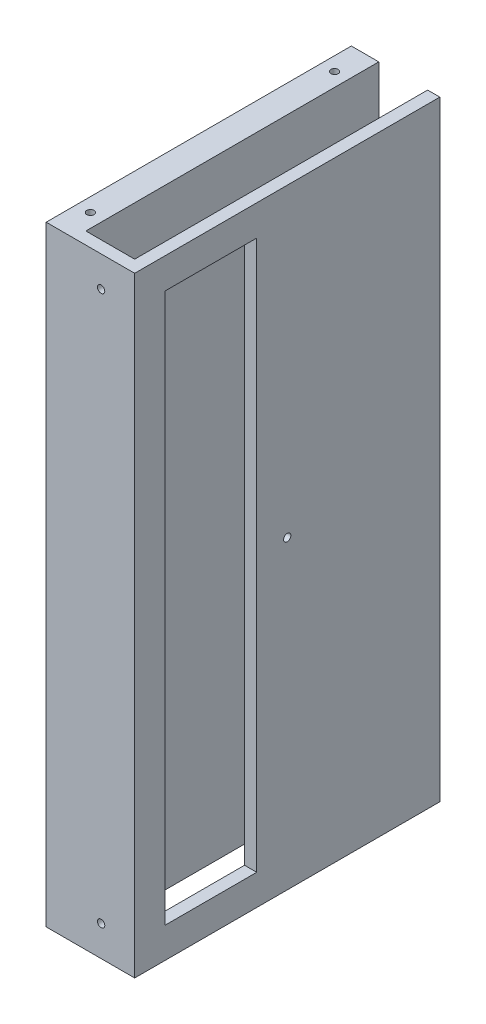
from build123d import *

# Parameters (mm, degrees)
SKETCH1_W                 = 29
SKETCH1_H                 = 100
BOSS_EXTRUDE1_DEPTH       = 200
SKETCH2_W                 = 16
SKETCH2_H                 = 96
CUT_EXTRUDE1_DEPTH        = 207.664583323
SKETCH3_W                 = 30
SKETCH3_H                 = 180
CUT_EXTRUDE2_DEPTH        = 4
M2_CLEARANCE_HOLE1_D      = 2.4
M2_CLEARANCE_HOLE1_DEPTH  = 11.2
M2_CLEARANCE_HOLE1_TIP    = 0.721032743
M2_CLEARANCE_HOLE2_D      = 2.4
M2_CLEARANCE_HOLE2_DEPTH  = 11.2
M2_CLEARANCE_HOLE2_TIP    = 0.721032743
M2_CLEARANCE_HOLE3_REACH  = 210.185
M2_CLEARANCE_HOLE3_BORE_R = 1.2
M2_CLEARANCE_HOLE4_REACH  = 210.185
M2_CLEARANCE_HOLE4_BORE_R = 1.2
M2_CLEARANCE_HOLE5_D      = 2.4


with BuildPart() as part:
    # Sketch1 → Boss-Extrude1 (new body)
    with BuildSketch(Plane(origin=(0, 0, 0), x_dir=(1, 0, 0), z_dir=(0, 1, 0))):
        Rectangle(SKETCH1_W, SKETCH1_H)
    extrude(amount=BOSS_EXTRUDE1_DEPTH)

    # Sketch2 → Cut-Extrude1 (cut, through all)
    with BuildSketch(Plane(origin=(0, 200, 0), x_dir=(1, 0, 0), z_dir=(0, 1, 0))):
        with Locations((2.5, 2)):
            Rectangle(SKETCH2_W, SKETCH2_H)
    extrude(amount=-CUT_EXTRUDE1_DEPTH, mode=Mode.SUBTRACT)

    # Sketch3 → Cut-Extrude2 (cut)
    with BuildSketch(Plane(origin=(14.5, 0, 0), x_dir=(0, 0, -1), z_dir=(1, 0, 0))):
        with Locations((-25, 100)):
            Rectangle(SKETCH3_W, SKETCH3_H)
    extrude(amount=-CUT_EXTRUDE2_DEPTH, mode=Mode.SUBTRACT)

    # M2 Clearance Hole1
    with Locations(Plane(origin=(0, 200, 0), x_dir=(1, 0, 0), z_dir=(0, 1, 0))):
        with Locations((-10, 40), (-10, -40)):
            Hole(M2_CLEARANCE_HOLE1_D / 2, depth=M2_CLEARANCE_HOLE1_DEPTH)
            with Locations((0, 0, -(M2_CLEARANCE_HOLE1_DEPTH + M2_CLEARANCE_HOLE1_TIP / 2))):  # 118° drill point
                Cone(0, M2_CLEARANCE_HOLE1_D / 2, M2_CLEARANCE_HOLE1_TIP, mode=Mode.SUBTRACT)

    # M2 Clearance Hole2
    with Locations(Plane(origin=(0, 0, 0), x_dir=(-1, 0, 0), z_dir=(0, -1, 0))):
        with Locations((10, 40), (10, -40)):
            Hole(M2_CLEARANCE_HOLE2_D / 2, depth=M2_CLEARANCE_HOLE2_DEPTH)
            with Locations((0, 0, -(M2_CLEARANCE_HOLE2_DEPTH + M2_CLEARANCE_HOLE2_TIP / 2))):  # 118° drill point
                Cone(0, M2_CLEARANCE_HOLE2_D / 2, M2_CLEARANCE_HOLE2_TIP, mode=Mode.SUBTRACT)

    # M2 Clearance Hole3 bore → M2 Clearance Hole3 (cut, up to next)
    with BuildSketch(Plane.ZY.offset(14.5), mode=Mode.PRIVATE) as m2_clearance_hole3_sk1:
        with Locations((-30, 180)):
            Circle(M2_CLEARANCE_HOLE3_BORE_R)
    m2_clearance_hole3_tool1 = extrude(m2_clearance_hole3_sk1.sketch, amount=-M2_CLEARANCE_HOLE3_REACH, mode=Mode.PRIVATE) & part.part
    # M2 Clearance Hole3 bore → M2 Clearance Hole3 (cut, up to next)
    with BuildSketch(Plane.ZY.offset(14.5), mode=Mode.PRIVATE) as m2_clearance_hole3_sk2:
        with Locations((-30, 20)):
            Circle(M2_CLEARANCE_HOLE3_BORE_R)
    m2_clearance_hole3_tool2 = extrude(m2_clearance_hole3_sk2.sketch, amount=-M2_CLEARANCE_HOLE3_REACH, mode=Mode.PRIVATE) & part.part
    # M2 Clearance Hole3 bore → M2 Clearance Hole3 (cut, up to next)
    with BuildSketch(Plane.ZY.offset(14.5), mode=Mode.PRIVATE) as m2_clearance_hole3_sk3:
        with Locations((30, 100)):
            Circle(M2_CLEARANCE_HOLE3_BORE_R)
    m2_clearance_hole3_tool3 = extrude(m2_clearance_hole3_sk3.sketch, amount=-M2_CLEARANCE_HOLE3_REACH, mode=Mode.PRIVATE) & part.part
    add(m2_clearance_hole3_tool1.solids().sort_by_distance((-14.5, 180, -30))[0], mode=Mode.SUBTRACT)
    add(m2_clearance_hole3_tool2.solids().sort_by_distance((-14.5, 20, -30))[0], mode=Mode.SUBTRACT)
    add(m2_clearance_hole3_tool3.solids().sort_by_distance((-14.5, 100, 30))[0], mode=Mode.SUBTRACT)

    # M2 Clearance Hole4 bore → M2 Clearance Hole4 (cut, up to next)
    with BuildSketch(Plane(origin=(14.5, 0, 0), x_dir=(0, 0, -1), z_dir=(1, 0, 0)), mode=Mode.PRIVATE) as m2_clearance_hole4_sk1:
        with Locations((0, 100)):
            Circle(M2_CLEARANCE_HOLE4_BORE_R)
    m2_clearance_hole4_tool1 = extrude(m2_clearance_hole4_sk1.sketch, amount=-M2_CLEARANCE_HOLE4_REACH, mode=Mode.PRIVATE) & part.part
    add(m2_clearance_hole4_tool1.solids().sort_by_distance((14.5, 100, 0))[0], mode=Mode.SUBTRACT)

    # M2 Clearance Hole5 (through all)
    with Locations(Plane.XY.offset(50)):
        with Locations((3.5, 10), (3.5, 190)):
            Hole(M2_CLEARANCE_HOLE5_D / 2)


solid = part.part
